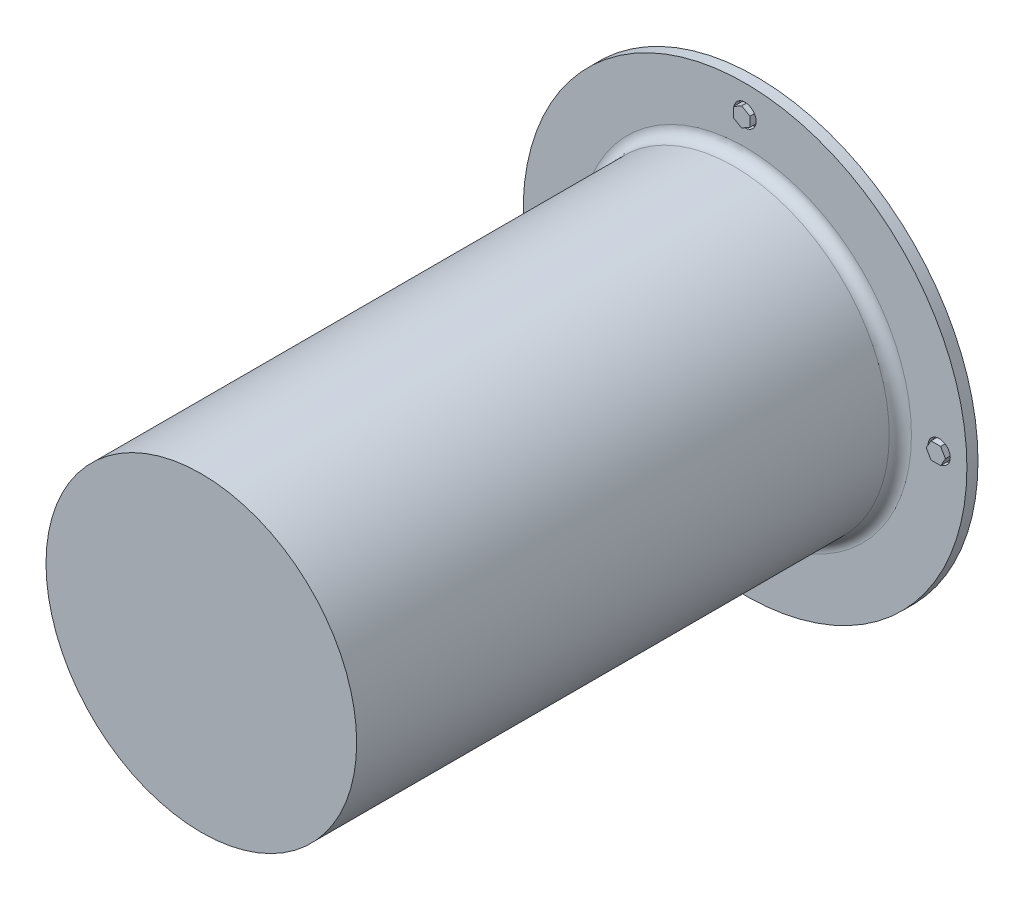
from build123d import *

# Parameters (mm, degrees)
SKIZZE1_R                       = 200
AUFSATZ_LINEAR_AUSTRAGEN1_DEPTH = 10
SKIZZE2_R                       = 140
AUFSATZ_LINEAR_AUSTRAGEN2_DEPTH = 490
VERRUNDUNG2_R                   = 10
SKIZZE8_R                       = 10
SCHNITT_LINEAR_AUSTRAGEN1_DEPTH = 5
AUFSATZ_LINEAR_AUSTRAGEN4_DEPTH = 8
WANDUNG1_T                      = 15


with BuildPart() as part:
    # Skizze1 → Aufsatz-Linear austragen1 (new body)
    with BuildSketch(Plane.XY):
        Circle(SKIZZE1_R)
    extrude(amount=AUFSATZ_LINEAR_AUSTRAGEN1_DEPTH)

    # Skizze2 → Aufsatz-Linear austragen2 (add)
    with BuildSketch(Plane.XY.offset(10)):
        Circle(SKIZZE2_R)
    extrude(amount=AUFSATZ_LINEAR_AUSTRAGEN2_DEPTH)

    # Verrundung2
    verrundung2_edges = [part.edges().sort_by_distance(p)[0] for p in [
        (-140, 0, 10),
    ]]
    fillet(verrundung2_edges, radius=VERRUNDUNG2_R)

    # Skizze8 → Schnitt-Linear austragen1 (cut)
    with BuildSketch(Plane.XY.offset(10)):
        with Locations((0, 175)):
            Circle(SKIZZE8_R)
        with Locations((175, 0)):
            Circle(SKIZZE8_R)
        with Locations((0, -175)):
            Circle(SKIZZE8_R)
        with Locations((-175, 0)):
            Circle(SKIZZE8_R)
    extrude(amount=-SCHNITT_LINEAR_AUSTRAGEN1_DEPTH, mode=Mode.SUBTRACT)

    # Skizze9 → Aufsatz-Linear austragen4 (add)
    with BuildSketch(Plane.XY.offset(5)):
        Polygon((0, 166.339745962), (7.5, 170.669872981), (7.5, 179.330127019), (0, 183.660254038), (-7.5, 179.330127019), (-7.5, 170.669872981), align=None)
        Polygon((-166.339745962, 0), (-170.669872981, 7.5), (-179.330127019, 7.5), (-183.660254038, 0), (-179.330127019, -7.5), (-170.669872981, -7.5), align=None)
        Polygon((166.339745962, 0), (170.669872981, -7.5), (179.330127019, -7.5), (183.660254038, 0), (179.330127019, 7.5), (170.669872981, 7.5), align=None)
        Polygon((0, -166.339745962), (-7.5, -170.669872981), (-7.5, -179.330127019), (0, -183.660254038), (7.5, -179.330127019), (7.5, -170.669872981), align=None)
    extrude(amount=AUFSATZ_LINEAR_AUSTRAGEN4_DEPTH)

    # Wandung1 (no face opened: a closed hollow body)
    add(offset(amount=-WANDUNG1_T, mode=Mode.PRIVATE), mode=Mode.SUBTRACT)


solid = part.part
